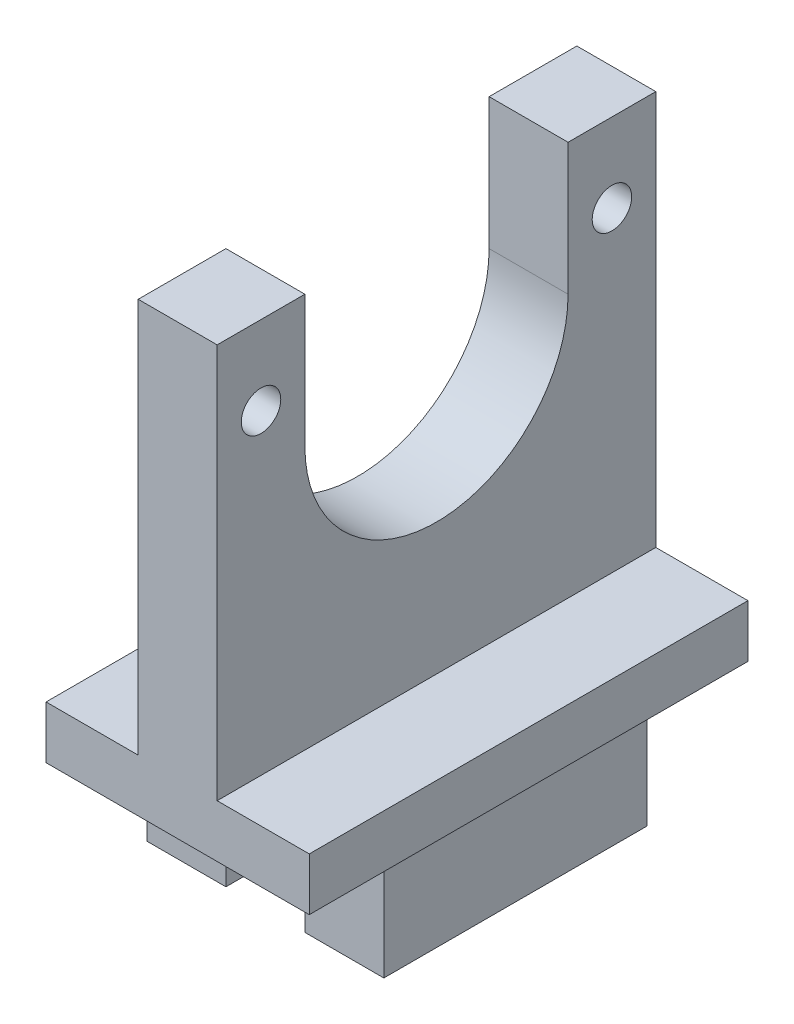
from build123d import *

# Parameters (mm, degrees)
BOSS_EXTRUDE1_DEPTH = 10
SKETCH2_W           = 10
SKETCH2_H           = 16.666666666
BOSS_EXTRUDE2_DEPTH = 2
SKETCH3_W           = 3
SKETCH3_H           = 15
BOSS_EXTRUDE3_DEPTH = 16.666666667
CUT_EXTRUDE1_DEPTH  = 25.104517788
SKETCH5_R           = 0.75
CUT_EXTRUDE2_DEPTH  = 25.104517788


with BuildPart() as part:
    # Sketch1 → Boss-Extrude1 (new body)
    with BuildSketch(Plane.XY):
        Polygon((-1.5, -2), (-1.5, 0), (1.5, 0), (1.5, -2), (4.5, -2), (4.5, 2), (-4.5, 2), (-4.5, -2), align=None)
    extrude(amount=BOSS_EXTRUDE1_DEPTH)

    # Sketch2 → Boss-Extrude2 (add)
    with BuildSketch(Plane(origin=(0, 2, 0), x_dir=(1, 0, 0), z_dir=(0, 1, 0))):
        with Locations((0, -5)):
            Rectangle(SKETCH2_W, SKETCH2_H)
    extrude(amount=BOSS_EXTRUDE2_DEPTH)

    # Sketch3 → Boss-Extrude3 (add)
    with BuildSketch(Plane.XY.offset(13.333333333)):
        with Locations((0, 11.5)):
            Rectangle(SKETCH3_W, SKETCH3_H)
    extrude(amount=-BOSS_EXTRUDE3_DEPTH)

    # Sketch4 → Cut-Extrude1 (cut, through all)
    with BuildSketch(Plane.ZY.offset(1.5)):
        with BuildLine():
            Line((0, 14), (0, 19))
            Line((0, 19), (10, 19))
            Line((10, 19), (10, 14))
            ThreePointArc((10, 14), (5, 9), (0, 14))
        make_face()
    extrude(amount=-CUT_EXTRUDE1_DEPTH, mode=Mode.SUBTRACT)

    # Sketch5 → Cut-Extrude2 (cut, through all)
    with BuildSketch(Plane.ZY.offset(1.5)):
        with Locations(Location((11.666666667, 16, 0), (0, 0, 270))):
            Circle(SKETCH5_R)
        with Locations(Location((-1.666666667, 16, 0), (0, 0, 270))):
            Circle(SKETCH5_R)
    extrude(amount=-CUT_EXTRUDE2_DEPTH, mode=Mode.SUBTRACT)


solid = part.part
